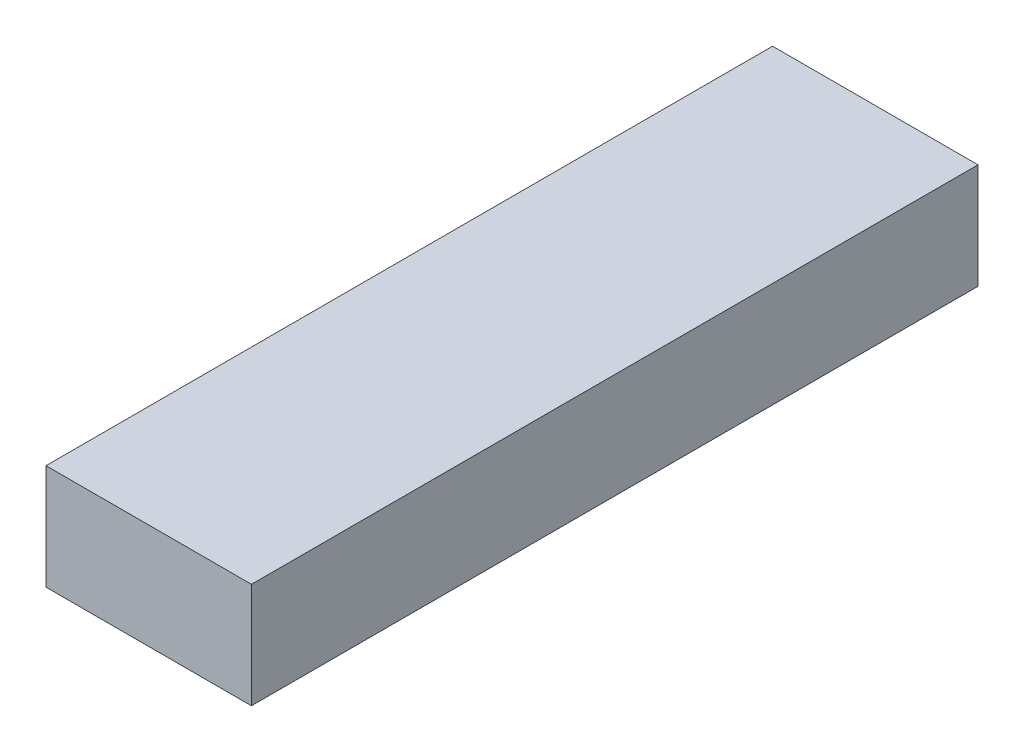
from build123d import *

# Parameters (mm, degrees)
SKETCH1_W           = 41
SKETCH1_H           = 21
BOSS_EXTRUDE1_DEPTH = 145


with BuildPart() as part:
    # Sketch1 → Boss-Extrude1 (new body)
    with BuildSketch(Plane.XY):
        Rectangle(SKETCH1_W, SKETCH1_H)
    extrude(amount=BOSS_EXTRUDE1_DEPTH)


solid = part.part
